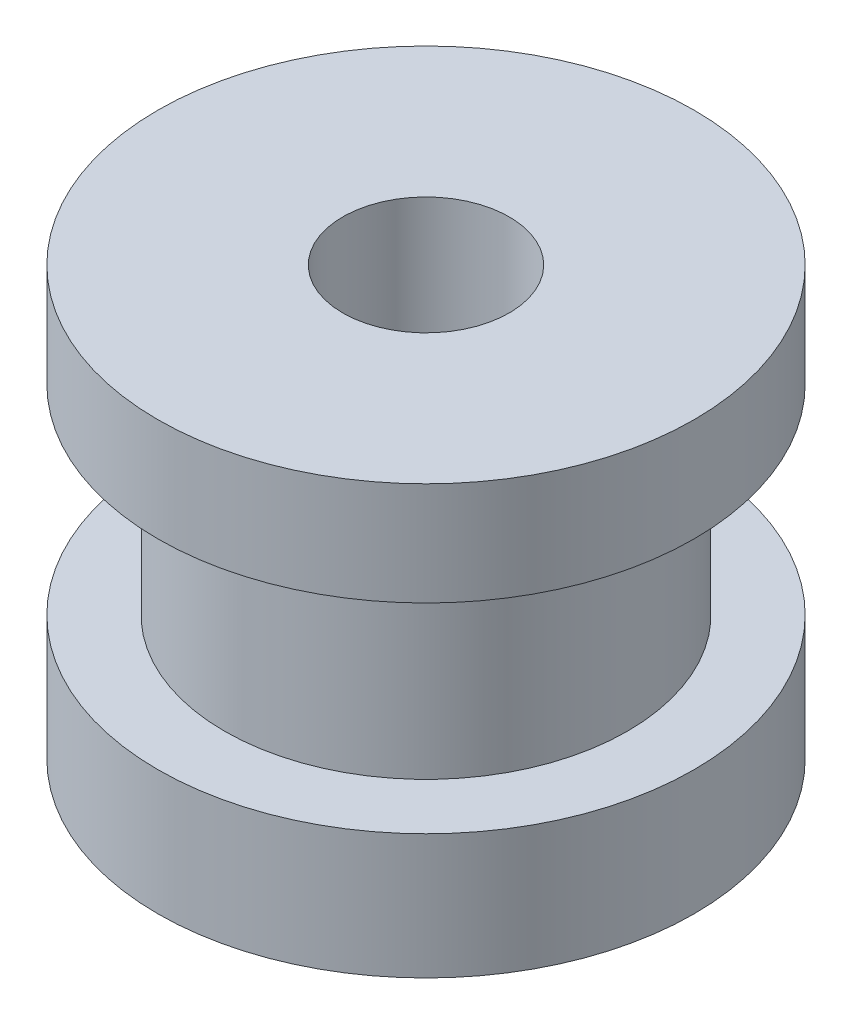
from build123d import *

# Parameters (mm, degrees)
SKETCH1_R           = 8.05
BOSS_EXTRUDE1_DEPTH = 3.75
SKETCH2_R           = 6.05
BOSS_EXTRUDE2_DEPTH = 6
SKETCH3_R           = 8.05
BOSS_EXTRUDE3_DEPTH = 3.1
SKETCH4_R           = 2.1
CUT_EXTRUDE1_DEPTH  = 6
SKETCH5_R           = 2.5
CUT_EXTRUDE2_DEPTH  = 7


with BuildPart() as part:
    # Sketch1 → Boss-Extrude1 (new body)
    with BuildSketch(Plane(origin=(0, 0, 0), x_dir=(1, 0, 0), z_dir=(0, 1, 0))):
        with Locations(Location((0, 0, 0), (0, 0, 270))):
            Circle(SKETCH1_R)
    extrude(amount=BOSS_EXTRUDE1_DEPTH)

    # Sketch2 → Boss-Extrude2 (add)
    with BuildSketch(Plane(origin=(0, 3.75, 0), x_dir=(1, 0, 0), z_dir=(0, 1, 0))):
        with Locations(Location((0, 0, 0), (0, 0, 270))):
            Circle(SKETCH2_R)
    extrude(amount=BOSS_EXTRUDE2_DEPTH)

    # Sketch3 → Boss-Extrude3 (add)
    with BuildSketch(Plane(origin=(0, 9.75, 0), x_dir=(1, 0, 0), z_dir=(0, 1, 0))):
        with Locations(Location((0, 0, 0), (0, 0, 270))):
            Circle(SKETCH3_R)
    extrude(amount=BOSS_EXTRUDE3_DEPTH)

    # Sketch4 → Cut-Extrude1 (cut)
    with BuildSketch(Plane.XZ):
        with Locations(Location((0, 0, 0), (0, 0, 270))):
            Circle(SKETCH4_R)
    extrude(amount=-CUT_EXTRUDE1_DEPTH, mode=Mode.SUBTRACT)

    # Sketch5 → Cut-Extrude2 (cut)
    with BuildSketch(Plane(origin=(0, 12.85, 0), x_dir=(1, 0, 0), z_dir=(0, 1, 0))):
        with Locations(Location((0, 0, 0), (0, 0, 270))):
            Circle(SKETCH5_R)
    extrude(amount=-CUT_EXTRUDE2_DEPTH, mode=Mode.SUBTRACT)


solid = part.part
